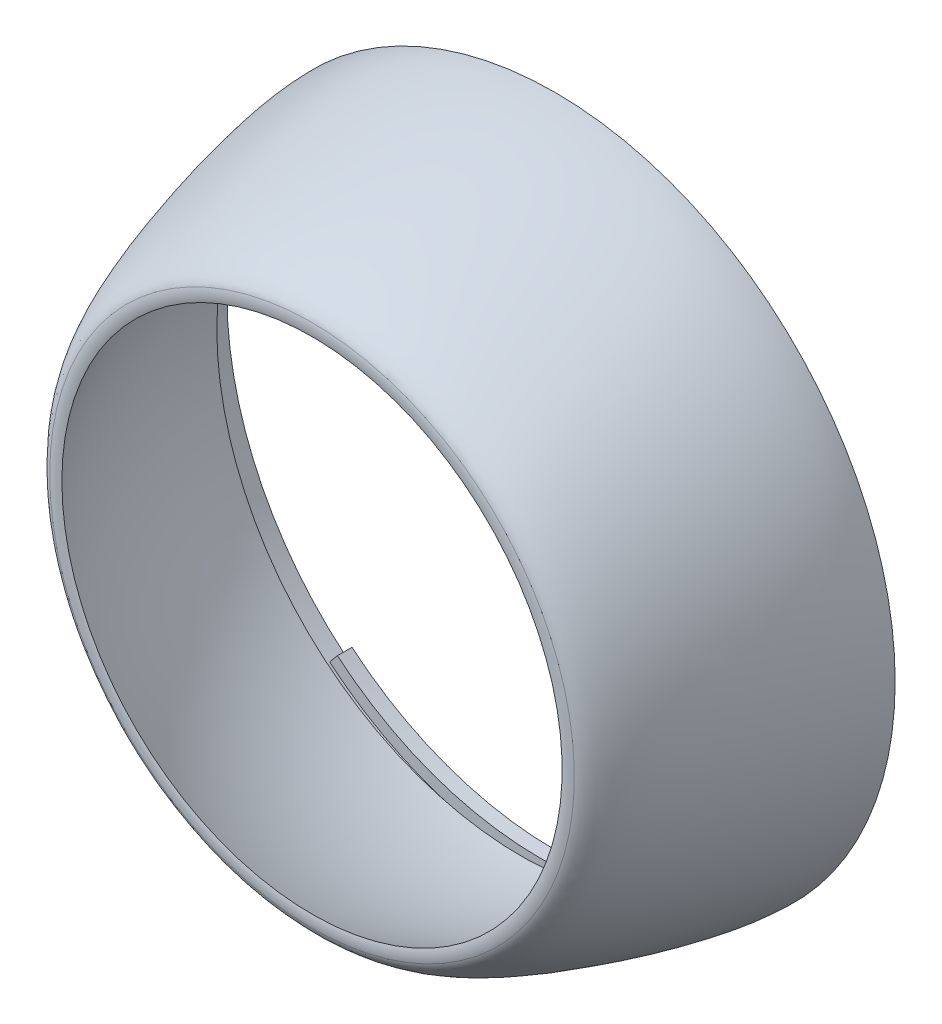
from build123d import *

# Parameters (mm, degrees)
SKETCH_3_R          = 25
CUT_EXTRUDE_5_DEPTH = 1.2
SKETCH_4_R          = 27
CUT_EXTRUDE_6_DEPTH = 1.6
CUT_EXTRUDE_START   = -1.2
SKETCH_5_R          = 26
CUT_EXTRUDE_7_DEPTH = 1.2


with BuildPart() as part:
    # 草图2 → 旋转1 (revolve)
    with BuildSketch(Plane(origin=(0, 0, 0), x_dir=(0, 0, -1), z_dir=(1, 0, 0)), mode=Mode.PRIVATE) as revolve_1_sk:
        with BuildLine():
            Line((0, 28), (0, 25))
            add(Edge.make_bspline(
                [(0, 25), (-10.585062144, 25.498744953), (-20, 20.589710795)],
                knots=[0, 0, 0, 1, 1, 1], degree=2))
            ThreePointArc((-20, 20.589710795), (-20.068500433, 21.089710795), (-20, 21.589710795))
            add(Edge.make_bspline(
                [(0, 28), (-2.203999875, 28.030003162), (-10.10077391, 26.539420738), (-19.553238288, 23.189614308), (-20, 21.589710795)],
                knots=[0, 0, 0, 0, 0.471702376, 1, 1, 1, 1], degree=3))
        make_face()
    revolve(revolve_1_sk.sketch.rotate(Axis((0, 0, 0), (0, 0, 1)), 90), axis=Axis((0, 0, 0), (0, 0, 1)))

    # 草图3 → 切除-拉伸5 (cut)
    with BuildSketch(Plane(origin=(0, 0, 0), x_dir=(-1, 0, 0), z_dir=(0, 0, -1))):
        Circle(SKETCH_3_R)
        with BuildLine():
            Line((0, 27), (0, 0))
            Line((0, 0), (-13.5, 23.382685902))
            ThreePointArc((-13.5, 23.382685902), (-6.988114218, 26.07999731), (0, 27))
        make_face()
        with BuildLine():
            Line((0, 0), (0, 25))
            ThreePointArc((0, 25), (-6.470476128, 24.148145657), (-12.5, 21.650635095))
            Line((-12.5, 21.650635095), (0, 0))
        make_face()
        with BuildLine():
            Line((-8.550503583, -23.49231552), (0, 0))
            Line((0, 0), (-23.49231552, -8.550503583))
            ThreePointArc((-23.49231552, -8.550503583), (-17.67766953, -17.67766953), (-8.550503583, -23.49231552))
        make_face()
        with BuildLine():
            Line((0, 0), (-25.371700761, -9.23454387))
            ThreePointArc((-25.371700761, -9.23454387), (-19.091883092, -19.091883092), (-9.23454387, -25.371700761))
            Line((-9.23454387, -25.371700761), (0, 0))
        make_face()
        with BuildLine():
            Line((23.49231552, 8.550503583), (0, 0))
            Line((0, 0), (16.069690242, -19.151111078))
            ThreePointArc((16.069690242, -19.151111078), (22.657694676, -10.565456544), (25, 0))
            ThreePointArc((25, 0), (24.620193825, 4.341204442), (23.49231552, 8.550503583))
        make_face()
        with BuildLine():
            Line((17.355265462, -20.683199964), (0, 0))
            Line((0, 0), (25.371700761, 9.23454387))
            ThreePointArc((25.371700761, 9.23454387), (26.07999731, -6.988114218), (17.355265462, -20.683199964))
        make_face()
    extrude(amount=-CUT_EXTRUDE_5_DEPTH, mode=Mode.SUBTRACT)

    # 草图4 → 切除-拉伸6 (cut)
    with BuildSketch(Plane(origin=(0, 0, 1.2), x_dir=(-1, 0, 0), z_dir=(0, 0, -1))):
        Circle(SKETCH_4_R)
    extrude(amount=-CUT_EXTRUDE_6_DEPTH, mode=Mode.SUBTRACT)

    # 草图5 → 切除-拉伸7 (cut)
    with BuildSketch(Plane(origin=(0, 0, 0), x_dir=(-1, 0, 0), z_dir=(0, 0, -1)).offset(CUT_EXTRUDE_START)):
        Circle(SKETCH_5_R)
    extrude(amount=CUT_EXTRUDE_7_DEPTH, mode=Mode.SUBTRACT)


solid = part.part
